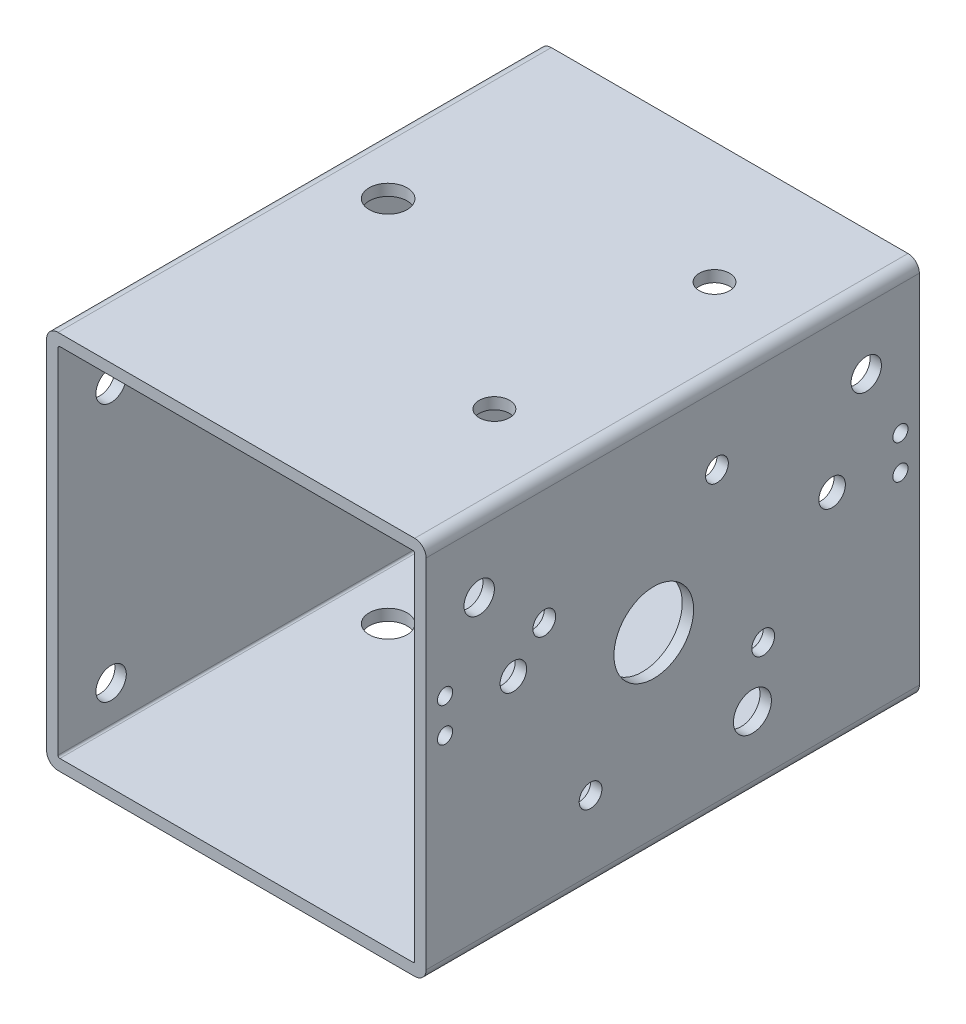
from build123d import *

# Parameters (mm, degrees)
SKETCH1_W                      = 100
SKETCH1_H                      = 100
SKETCH1_W_2                    = 94
SKETCH1_H_2                    = 94
EXTRUDE_THIN1_DEPTH            = 130
FILLET1_R                      = 0.5
FILLET2_R                      = 3
F_8_0_8_DIAMETER_HOLE2_D       = 8
F_8_0_8_DIAMETER_HOLE3_D       = 8
F_10_0_10_DIAMETER_HOLE1_D     = 10
F_10_0_10_DIAMETER_HOLE2_D     = 10
M8_TAPPED_HOLE1_D              = 6.8
M8_TAPPED_HOLE1_DEPTH          = 3
M8_TAPPED_HOLE2_D              = 6.8
M8_TAPPED_HOLE2_DEPTH          = 3
F_21_0_21_DIAMETER_HOLE1_D     = 21
F_21_0_21_DIAMETER_HOLE1_DEPTH = 3
F_6_0_6_DIAMETER_HOLE1_D       = 6
F_6_0_6_DIAMETER_HOLE1_DEPTH   = 3
CUT_EXTRUDE1_REACH             = 173.464
SKETCH27_R                     = 2
SKETCH27_R_2                   = 3.5
CUT_EXTRUDE2_REACH             = 173.464
SKETCH31_R                     = 4


with BuildPart() as part:
    # Sketch1 → Extrude-Thin1 (new body)
    with BuildSketch(Plane.XY):
        Rectangle(SKETCH1_W, SKETCH1_H)
        Rectangle(SKETCH1_W_2, SKETCH1_H_2, mode=Mode.SUBTRACT)
    extrude(amount=EXTRUDE_THIN1_DEPTH)

    # Fillet1
    fillet1_edges = [part.edges().sort_by_distance(p)[0] for p in [
        (47, -47, 65),
        (47, 47, 65),
        (-47, 47, 65),
        (-47, -47, 65),
    ]]
    fillet(fillet1_edges, radius=FILLET1_R)

    # Fillet2
    fillet2_edges = [part.edges().sort_by_distance(p)[0] for p in [
        (50, -50, 65),
        (-50, -50, 65),
        (-50, 50, 65),
        (50, 50, 65),
    ]]
    fillet(fillet2_edges, radius=FILLET2_R)

    # Ø8.0 (8) Diameter Hole2 (through all)
    with Locations(Plane(origin=(0, 50, 0), x_dir=(1, 0, 0), z_dir=(0, 1, 0))):
        with Locations((28, -32), (28, -90)):
            Hole(F_8_0_8_DIAMETER_HOLE2_D / 2)

    # Ø8.0 (8) Diameter Hole3 (through all)
    with Locations(Plane(origin=(50, 0, 0), x_dir=(0, 0, -1), z_dir=(1, 0, 0))):
        with Locations((-14, 31), (-116, 31)):
            Hole(F_8_0_8_DIAMETER_HOLE3_D / 2)

    # Ø10.0 (10) Diameter Hole1 (through all)
    with Locations(Plane(origin=(0, 50, 0), x_dir=(1, 0, 0), z_dir=(0, 1, 0))):
        with Locations((-34, -56)):
            Hole(F_10_0_10_DIAMETER_HOLE1_D / 2)

    # Ø10.0 (10) Diameter Hole2 (through all)
    with Locations(Plane(origin=(50, 0, 0), x_dir=(0, 0, -1), z_dir=(1, 0, 0))):
        with Locations((-44, -31)):
            Hole(F_10_0_10_DIAMETER_HOLE2_D / 2)

    # M8 Tapped Hole1
    with Locations(Plane.ZY.offset(50)):
        with Locations((56, -15), (56, 35)):
            Hole(M8_TAPPED_HOLE1_D / 2, depth=M8_TAPPED_HOLE1_DEPTH)

    # M8 Tapped Hole2
    with Locations(Plane(origin=(0, -50, 0), x_dir=(-1, 0, 0), z_dir=(0, -1, 0))):
        with Locations((20, -44), (-35, -44)):
            Hole(M8_TAPPED_HOLE2_D / 2, depth=M8_TAPPED_HOLE2_DEPTH)

    # Ø21.0 (21) Diameter Hole1
    with Locations(Plane(origin=(50, 0, 0), x_dir=(0, 0, -1), z_dir=(1, 0, 0))):
        with Locations((-70, 0)):
            Hole(F_21_0_21_DIAMETER_HOLE1_D / 2, depth=F_21_0_21_DIAMETER_HOLE1_DEPTH)

    # Ø6.0 (6) Diameter Hole1
    with Locations(Plane(origin=(50, 0, 0), x_dir=(0, 0, -1), z_dir=(1, 0, 0))):
        with Locations((-41.157258279, -16.652364697), (-53.347635303, 28.842741721), (-98.842741721, 16.652364697), (-86.652364697, -28.842741721)):
            Hole(F_6_0_6_DIAMETER_HOLE1_D / 2, depth=F_6_0_6_DIAMETER_HOLE1_DEPTH)

    # Sketch27 → Cut-Extrude1 (cut, up to next)
    with BuildSketch(Plane(origin=(50, 0, 0), x_dir=(0, 0, -1), z_dir=(1, 0, 0)), mode=Mode.PRIVATE) as cut_extrude1_sk1:
        with Locations(Location((-5, 13, 0), (0, 0, 90))):
            Circle(SKETCH27_R)
    cut_extrude1_tool1 = extrude(cut_extrude1_sk1.sketch, amount=-CUT_EXTRUDE1_REACH, mode=Mode.PRIVATE) & part.part
    # Sketch27 → Cut-Extrude1 (cut, up to next)
    with BuildSketch(Plane(origin=(50, 0, 0), x_dir=(0, 0, -1), z_dir=(1, 0, 0)), mode=Mode.PRIVATE) as cut_extrude1_sk2:
        with Locations(Location((-5, 4, 0), (0, 0, 90))):
            Circle(SKETCH27_R)
    cut_extrude1_tool2 = extrude(cut_extrude1_sk2.sketch, amount=-CUT_EXTRUDE1_REACH, mode=Mode.PRIVATE) & part.part
    # Sketch27 → Cut-Extrude1 (cut, up to next)
    with BuildSketch(Plane(origin=(50, 0, 0), x_dir=(0, 0, -1), z_dir=(1, 0, 0)), mode=Mode.PRIVATE) as cut_extrude1_sk3:
        with Locations(Location((-23, 8.5, 0), (0, 0, 90))):
            Circle(SKETCH27_R_2)
    cut_extrude1_tool3 = extrude(cut_extrude1_sk3.sketch, amount=-CUT_EXTRUDE1_REACH, mode=Mode.PRIVATE) & part.part
    # Sketch27 → Cut-Extrude1 (cut, up to next)
    with BuildSketch(Plane(origin=(50, 0, 0), x_dir=(0, 0, -1), z_dir=(1, 0, 0)), mode=Mode.PRIVATE) as cut_extrude1_sk4:
        with Locations(Location((-107, 8.5, 0), (0, 0, 270))):
            Circle(SKETCH27_R_2)
    cut_extrude1_tool4 = extrude(cut_extrude1_sk4.sketch, amount=-CUT_EXTRUDE1_REACH, mode=Mode.PRIVATE) & part.part
    # Sketch27 → Cut-Extrude1 (cut, up to next)
    with BuildSketch(Plane(origin=(50, 0, 0), x_dir=(0, 0, -1), z_dir=(1, 0, 0)), mode=Mode.PRIVATE) as cut_extrude1_sk5:
        with Locations(Location((-125, 4, 0), (0, 0, 270))):
            Circle(SKETCH27_R)
    cut_extrude1_tool5 = extrude(cut_extrude1_sk5.sketch, amount=-CUT_EXTRUDE1_REACH, mode=Mode.PRIVATE) & part.part
    # Sketch27 → Cut-Extrude1 (cut, up to next)
    with BuildSketch(Plane(origin=(50, 0, 0), x_dir=(0, 0, -1), z_dir=(1, 0, 0)), mode=Mode.PRIVATE) as cut_extrude1_sk6:
        with Locations(Location((-125, 13, 0), (0, 0, 270))):
            Circle(SKETCH27_R)
    cut_extrude1_tool6 = extrude(cut_extrude1_sk6.sketch, amount=-CUT_EXTRUDE1_REACH, mode=Mode.PRIVATE) & part.part
    add(cut_extrude1_tool1.solids().sort_by_distance((50, 13, 5))[0], mode=Mode.SUBTRACT)
    add(cut_extrude1_tool2.solids().sort_by_distance((50, 4, 5))[0], mode=Mode.SUBTRACT)
    add(cut_extrude1_tool3.solids().sort_by_distance((50, 8.5, 23))[0], mode=Mode.SUBTRACT)
    add(cut_extrude1_tool4.solids().sort_by_distance((50, 8.5, 107))[0], mode=Mode.SUBTRACT)
    add(cut_extrude1_tool5.solids().sort_by_distance((50, 4, 125))[0], mode=Mode.SUBTRACT)
    add(cut_extrude1_tool6.solids().sort_by_distance((50, 13, 125))[0], mode=Mode.SUBTRACT)

    # Sketch31 → Cut-Extrude2 (cut, up to next)
    with BuildSketch(Plane.ZY.offset(50), mode=Mode.PRIVATE) as cut_extrude2_sk1:
        with Locations(Location((14, -37, 0), (0, 0, 270))):
            Circle(SKETCH31_R)
    cut_extrude2_tool1 = extrude(cut_extrude2_sk1.sketch, amount=-CUT_EXTRUDE2_REACH, mode=Mode.PRIVATE) & part.part
    # Sketch31 → Cut-Extrude2 (cut, up to next)
    with BuildSketch(Plane.ZY.offset(50), mode=Mode.PRIVATE) as cut_extrude2_sk2:
        with Locations(Location((116, -37, 0), (0, 0, 270))):
            Circle(SKETCH31_R)
    cut_extrude2_tool2 = extrude(cut_extrude2_sk2.sketch, amount=-CUT_EXTRUDE2_REACH, mode=Mode.PRIVATE) & part.part
    add(cut_extrude2_tool1.solids().sort_by_distance((-50, -37, 14))[0], mode=Mode.SUBTRACT)
    add(cut_extrude2_tool2.solids().sort_by_distance((-50, -37, 116))[0], mode=Mode.SUBTRACT)


solid = part.part
